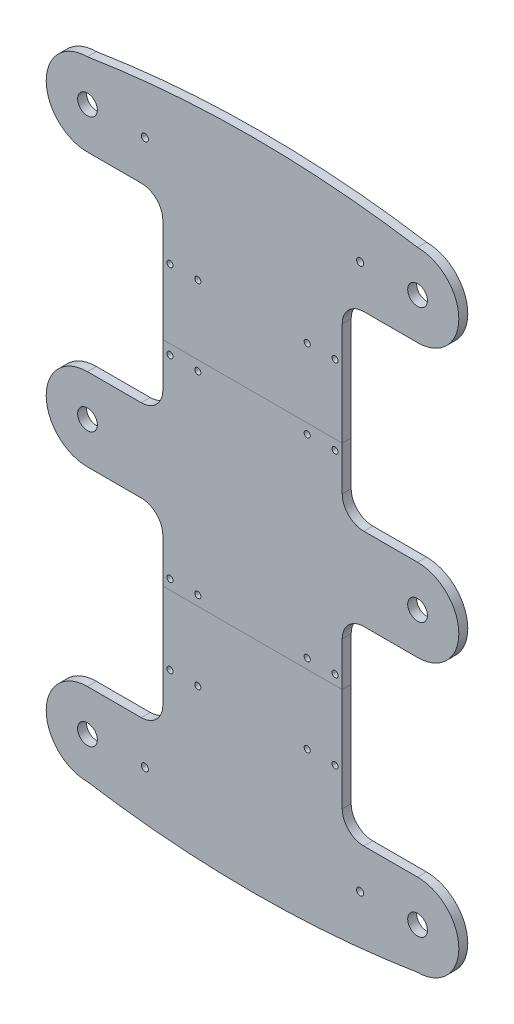
from build123d import *

# Parameters (mm, degrees)
DODANIE_WYCI_GNI_CIE1_DEPTH = 5
SZKIC3_R                    = 5.5
WYTNIJ_WYCI_GNI_CIE1_DEPTH  = 216.603683599
SZKIC5_R                    = 1.7
SZKIC5_R_2                  = 2
WYTNIJ_WYCI_GNI_CIE2_DEPTH  = 216.603683599
PODZIEL1_SURFACE_1_1_BACK   = 432.12
PODZIEL1_SURFACE_1_1_DEPTH  = 864.24
PODZIEL1_SURFACE_1_2_BACK   = 432.12
PODZIEL1_SURFACE_1_2_DEPTH  = 864.24
PODZIEL1_SURFACE_2_3_BACK   = 432.12
PODZIEL1_SURFACE_2_3_DEPTH  = 864.24
PODZIEL1_SURFACE_2_4_BACK   = 432.12
PODZIEL1_SURFACE_2_4_DEPTH  = 864.24


with BuildPart() as part:
    # Szkic1 → Dodanie-wyciągnięcie1 (new body)
    with BuildSketch(Plane.XY):
        with BuildLine():
            Line((-50, -116.998971504), (-50, -35.001028496))
            ThreePointArc((-50, -35.001028496), (-53.514718626, -26.515747122), (-62, -23.001028496))
            Line((-62, -23.001028496), (-92, -23.001028496))
            ThreePointArc((-92, -23.001028496), (-115.001028496, 0), (-92, 23.001028496))
            Line((-92, 23.001028496), (-62, 23.001028496))
            ThreePointArc((-62, 23.001028496), (-53.514718626, 26.515747122), (-50, 35.001028496))
            Line((-50, 35.001028496), (-50, 116.998971504))
            ThreePointArc((-50, 116.998971504), (-53.514718626, 125.484252878), (-62, 128.998971504))
            Line((-62, 128.998971504), (-92, 128.998971504))
            ThreePointArc((-92, 128.998971504), (-115.001028496, 152), (-92, 175.001028496))
            ThreePointArc((-92, 175.001028496), (0, 182.303899646), (92, 175.001028496))
            ThreePointArc((92, 175.001028496), (115.001028496, 152), (92, 128.998971504))
            Line((92, 128.998971504), (62, 128.998971504))
            ThreePointArc((62, 128.998971504), (53.514718626, 125.484252878), (50, 116.998971504))
            Line((50, 116.998971504), (50, 35.001028496))
            ThreePointArc((50, 35.001028496), (53.514718626, 26.515747122), (62, 23.001028496))
            Line((62, 23.001028496), (92, 23.001028496))
            ThreePointArc((92, 23.001028496), (115.001028496, 0), (92, -23.001028496))
            Line((92, -23.001028496), (62, -23.001028496))
            ThreePointArc((62, -23.001028496), (53.514718626, -26.515747122), (50, -35.001028496))
            Line((50, -35.001028496), (50, -116.998971504))
            ThreePointArc((50, -116.998971504), (53.514718626, -125.484252878), (62, -128.998971504))
            Line((62, -128.998971504), (92, -128.998971504))
            ThreePointArc((92, -128.998971504), (115.001028496, -152), (92, -175.001028496))
            ThreePointArc((92, -175.001028496), (0, -182.303899646), (-92, -175.001028496))
            ThreePointArc((-92, -175.001028496), (-115.001028496, -152), (-92, -128.998971504))
            Line((-92, -128.998971504), (-62, -128.998971504))
            ThreePointArc((-62, -128.998971504), (-53.514718626, -125.484252878), (-50, -116.998971504))
        make_face()
    extrude(amount=DODANIE_WYCI_GNI_CIE1_DEPTH)

    # Szkic3 → Wytnij-wyciągnięcie1 (cut, through all)
    with BuildSketch(Plane.XY.offset(5)):
        with Locations(Location((92, 0, 0), (0, 0, 180))):
            Circle(SZKIC3_R)
        with Locations((-92, 0)):
            Circle(SZKIC3_R)
        with Locations((92, 152)):
            Circle(SZKIC3_R)
        with Locations(Location((-92, 152, 0), (0, 0, 180))):
            Circle(SZKIC3_R)
        with Locations((92, -152)):
            Circle(SZKIC3_R)
        with Locations(Location((-92, -152, 0), (0, 0, 180))):
            Circle(SZKIC3_R)
    extrude(amount=-WYTNIJ_WYCI_GNI_CIE1_DEPTH, mode=Mode.SUBTRACT)

    # Szkic5 → Wytnij-wyciągnięcie2 (cut, through all)
    with BuildSketch(Plane.XY.offset(5)):
        with Locations(Location((-46, 54.001028496, 0), (0, 0, 180))):
            Circle(SZKIC5_R)
        with Locations((-60, -152)):
            Circle(SZKIC5_R_2)
        with Locations(Location((60, -152, 0), (0, 0, 180))):
            Circle(SZKIC5_R_2)
        with Locations((60, 152)):
            Circle(SZKIC5_R_2)
        with Locations(Location((-60, 152, 0), (0, 0, 180))):
            Circle(SZKIC5_R_2)
        with Locations((-46, 97.998971504)):
            Circle(SZKIC5_R)
        with Locations(Location((-30.5, 97.998971504, 0), (0, 0, 180))):
            Circle(SZKIC5_R)
        with Locations((-30.5, 54.001028496)):
            Circle(SZKIC5_R)
        with Locations((46, 54.001028496)):
            Circle(SZKIC5_R)
        with Locations(Location((30.5, 54.001028496, 0), (0, 0, 180))):
            Circle(SZKIC5_R)
        with Locations(Location((46, 97.998971504, 0), (0, 0, 180))):
            Circle(SZKIC5_R)
        with Locations((30.5, 97.998971504)):
            Circle(SZKIC5_R)
        with Locations(Location((-30.5, -54.001028496, 0), (0, 0, 180))):
            Circle(SZKIC5_R)
        with Locations((-30.5, -97.998971504)):
            Circle(SZKIC5_R)
        with Locations(Location((-46, -97.998971504, 0), (0, 0, 180))):
            Circle(SZKIC5_R)
        with Locations((-46, -54.001028496)):
            Circle(SZKIC5_R)
        with Locations(Location((30.5, -97.998971504, 0), (0, 0, 180))):
            Circle(SZKIC5_R)
        with Locations((46, -97.998971504)):
            Circle(SZKIC5_R)
        with Locations((30.5, -54.001028496)):
            Circle(SZKIC5_R)
        with Locations(Location((46, -54.001028496, 0), (0, 0, 180))):
            Circle(SZKIC5_R)
    extrude(amount=-WYTNIJ_WYCI_GNI_CIE2_DEPTH, mode=Mode.SUBTRACT)


with BuildPart() as body_2:
    # Podziel1: the piece behind the surface
    add(part.part)
    # Podziel1 surface 1: a surface, the sketch's curves swept straight by 864.24 mm
    with BuildLine(Plane.XY.offset(5).offset(-PODZIEL1_SURFACE_1_1_BACK), mode=Mode.PRIVATE) as podziel1_surface_1_1_path:
        Line((-67.576042678, 59.5), (69.029290908, 59.5))
    podziel1_surface_1_1 = Shell.extrude(podziel1_surface_1_1_path.wire(), (0 * PODZIEL1_SURFACE_1_1_DEPTH, 0 * PODZIEL1_SURFACE_1_1_DEPTH, 1 * PODZIEL1_SURFACE_1_1_DEPTH))
    split(bisect_by=podziel1_surface_1_1, keep=Keep.BOTTOM)


with BuildPart() as part_1:
    add(part.part)

    # Podziel1: split by a surface, the side it looks to stays
    # Podziel1 surface 1: a surface, the sketch's curves swept straight by 864.24 mm
    with BuildLine(Plane.XY.offset(5).offset(-PODZIEL1_SURFACE_1_2_BACK), mode=Mode.PRIVATE) as podziel1_surface_1_2_path:
        Line((-67.576042678, 59.5), (69.029290908, 59.5))
    podziel1_surface_1_2 = Shell.extrude(podziel1_surface_1_2_path.wire(), (0 * PODZIEL1_SURFACE_1_2_DEPTH, 0 * PODZIEL1_SURFACE_1_2_DEPTH, 1 * PODZIEL1_SURFACE_1_2_DEPTH))
    split(bisect_by=podziel1_surface_1_2, keep=Keep.TOP)


with BuildPart() as body_3:
    # Podziel1 2 body 2: the piece behind the surface
    add(body_2.part)
    # Podziel1 surface 2: a surface, the sketch's curves swept straight by 864.24 mm
    with BuildLine(Plane.XY.offset(5).offset(-PODZIEL1_SURFACE_2_3_BACK), mode=Mode.PRIVATE) as podziel1_surface_2_3_path:
        Line((-67.576042678, -59.5), (69.029290908, -59.5))
    podziel1_surface_2_3 = Shell.extrude(podziel1_surface_2_3_path.wire(), (0 * PODZIEL1_SURFACE_2_3_DEPTH, 0 * PODZIEL1_SURFACE_2_3_DEPTH, 1 * PODZIEL1_SURFACE_2_3_DEPTH))
    split(bisect_by=podziel1_surface_2_3, keep=Keep.BOTTOM)


with BuildPart() as body_2_1:
    add(body_2.part)

    # Podziel1 2 body 2: split by a surface, the side it looks to stays
    # Podziel1 surface 2: a surface, the sketch's curves swept straight by 864.24 mm
    with BuildLine(Plane.XY.offset(5).offset(-PODZIEL1_SURFACE_2_4_BACK), mode=Mode.PRIVATE) as podziel1_surface_2_4_path:
        Line((-67.576042678, -59.5), (69.029290908, -59.5))
    podziel1_surface_2_4 = Shell.extrude(podziel1_surface_2_4_path.wire(), (0 * PODZIEL1_SURFACE_2_4_DEPTH, 0 * PODZIEL1_SURFACE_2_4_DEPTH, 1 * PODZIEL1_SURFACE_2_4_DEPTH))
    split(bisect_by=podziel1_surface_2_4, keep=Keep.TOP)


solid = Compound([part_1.part, body_3.part, body_2_1.part])
